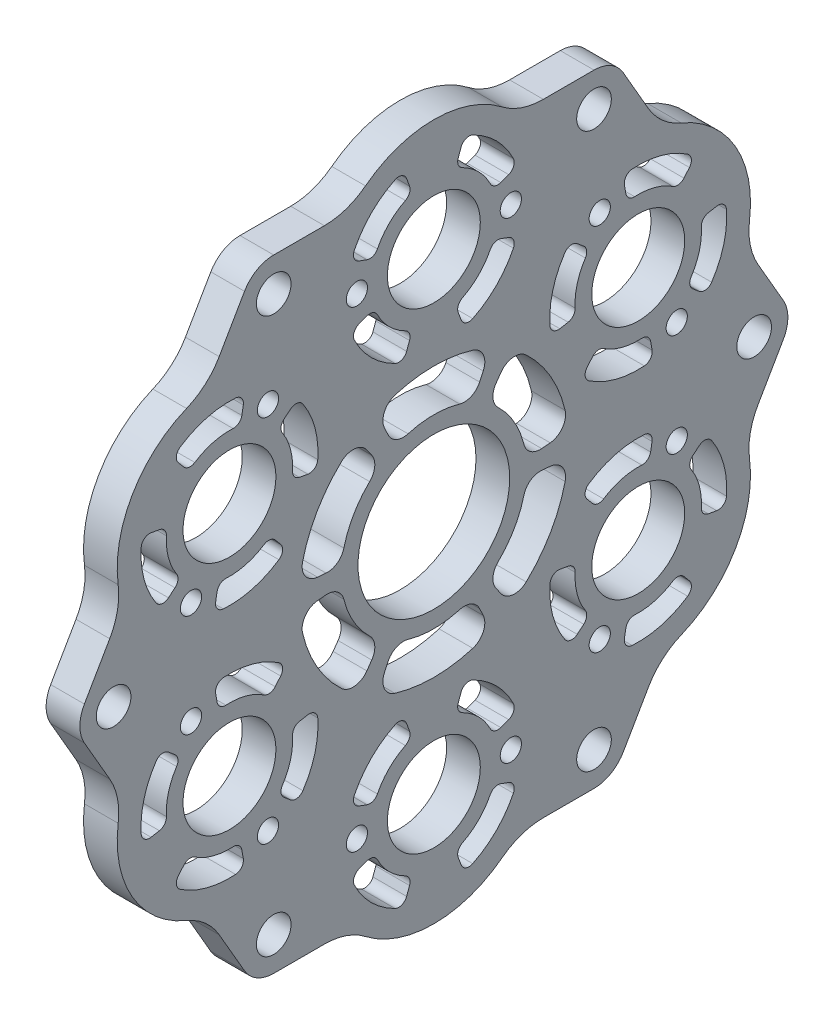
from build123d import *

# Parameters (mm, degrees)
SKETCH1_R                = 3.2639
BOSS_EXTRUDE1_DEPTH      = 6.35
FILLET1_R                = 12.7
SKETCH2_R                = 8.7503
SKETCH2_R_2              = 14.2875
CUT_EXTRUDE1_DEPTH       = 162.968435645
CUT_EXTRUDE2_DEPTH       = 162.968435645
FILLET2_R                = 1.5875
SKETCH4_R                = 1.999996
CUT_EXTRUDE3_DEPTH       = 162.968435645
CUT_EXTRUDE4_DEPTH       = 162.968435645
CIRPATTERN3_COUNT        = 6
FILLET2_OF_CIRPATTERN3_R = 1.5875


with BuildPart() as part:
    # Sketch1 → Boss-Extrude1 (new body)
    with BuildSketch(Plane(origin=(0, 0, 0), x_dir=(0, 0, -1), z_dir=(1, 0, 0))):
        with BuildLine():
            Line((-139.882849365, 15.682852399), (-147.104261314, 3.175))
            ThreePointArc((-147.104261314, 3.175), (-147.955, 0), (-147.104261314, -3.175))
            Line((-147.104261314, -3.175), (-139.882849365, -15.682852399))
            ThreePointArc((-139.882849365, -15.682852399), (-138.087369374, -32.79775), (-124.163173263, -42.910130085))
            Line((-124.163173263, -42.910130085), (-116.941761314, -55.417982483))
            ThreePointArc((-116.941761314, -55.417982483), (-114.6175, -57.742243797), (-111.4425, -58.592982483))
            Line((-111.4425, -58.592982483), (-96.999676101, -58.592982483))
            ThreePointArc((-96.999676101, -58.592982483), (-81.28, -65.5955), (-65.560323899, -58.592982483))
            Line((-65.560323899, -58.592982483), (-51.1175, -58.592982483))
            ThreePointArc((-51.1175, -58.592982483), (-47.9425, -57.742243797), (-45.618238686, -55.417982483))
            Line((-45.618238686, -55.417982483), (-38.396826737, -42.910130085))
            ThreePointArc((-38.396826737, -42.910130085), (-24.472630626, -32.79775), (-22.677150635, -15.682852399))
            Line((-22.677150635, -15.682852399), (-15.455738686, -3.175))
            ThreePointArc((-15.455738686, -3.175), (-14.605, 0), (-15.455738686, 3.175))
            Line((-15.455738686, 3.175), (-22.677150635, 15.682852399))
            ThreePointArc((-22.677150635, 15.682852399), (-24.472630626, 32.79775), (-38.396826737, 42.910130085))
            Line((-38.396826737, 42.910130085), (-45.618238686, 55.417982483))
            ThreePointArc((-45.618238686, 55.417982483), (-47.9425, 57.742243797), (-51.1175, 58.592982483))
            Line((-51.1175, 58.592982483), (-65.560323899, 58.592982483))
            ThreePointArc((-65.560323899, 58.592982483), (-81.28, 65.5955), (-96.999676101, 58.592982483))
            Line((-96.999676101, 58.592982483), (-111.4425, 58.592982483))
            ThreePointArc((-111.4425, 58.592982483), (-114.6175, 57.742243797), (-116.941761314, 55.417982483))
            Line((-116.941761314, 55.417982483), (-124.163173263, 42.910130085))
            ThreePointArc((-124.163173263, 42.910130085), (-138.087369374, 32.79775), (-139.882849365, 15.682852399))
        make_face()
        with Locations((-141.605, 0)):
            Circle(SKETCH1_R, mode=Mode.SUBTRACT)
        with Locations((-111.4425, -52.242982483)):
            Circle(SKETCH1_R, mode=Mode.SUBTRACT)
        with Locations((-111.4425, 52.242982483)):
            Circle(SKETCH1_R, mode=Mode.SUBTRACT)
        with Locations((-51.1175, -52.242982483)):
            Circle(SKETCH1_R, mode=Mode.SUBTRACT)
        with Locations((-51.1175, 52.242982483)):
            Circle(SKETCH1_R, mode=Mode.SUBTRACT)
        with Locations((-20.955, 0)):
            Circle(SKETCH1_R, mode=Mode.SUBTRACT)
    extrude(amount=BOSS_EXTRUDE1_DEPTH)

    # Fillet1
    fillet1_edges = [part.edges().sort_by_distance(p)[0] for p in [
        (3.175, 58.592982483, 96.999676101),
        (3.175, 58.592982483, 65.560323899),
        (3.175, 42.910130085, 38.396826737),
        (3.175, 15.682852399, 22.677150635),
        (3.175, -15.682852399, 22.677150635),
        (3.175, -42.910130085, 38.396826737),
        (3.175, -58.592982483, 65.560323899),
        (3.175, -58.592982483, 96.999676101),
        (3.175, -42.910130085, 124.163173263),
        (3.175, -15.682852399, 139.882849365),
        (3.175, 15.682852399, 139.882849365),
        (3.175, 42.910130085, 124.163173263),
    ]]
    fillet(fillet1_edges, radius=FILLET1_R)

    # Sketch2 → Cut-Extrude1 (cut, through all)
    with BuildSketch(Plane(origin=(6.35, 0, 0), x_dir=(0, 0, -1), z_dir=(1, 0, 0))):
        with Locations((-119.774829198, -22.225)):
            Circle(SKETCH2_R)
        with Locations((-81.28, -44.45)):
            Circle(SKETCH2_R)
        with Locations((-42.785170802, -22.225)):
            Circle(SKETCH2_R)
        with Locations((-42.785170802, 22.225)):
            Circle(SKETCH2_R)
        with Locations((-81.28, 44.45)):
            Circle(SKETCH2_R)
        with Locations((-119.774829198, 22.225)):
            Circle(SKETCH2_R)
        with Locations((-81.28, 0)):
            Circle(SKETCH2_R_2)
    extrude(amount=-CUT_EXTRUDE1_DEPTH, mode=Mode.SUBTRACT)

    # Sketch3 → Cut-Extrude2 (cut, through all)
    with BuildSketch(Plane(origin=(6.35, 0, 0), x_dir=(0, 0, -1), z_dir=(1, 0, 0))):
        with BuildLine():
            Line((-85.352177331, 55.638215266), (-86.981048264, 60.113501373))
            ThreePointArc((-86.981048264, 60.113501373), (-93.066586159, 56.236586159), (-96.943501373, 50.151048264))
            Line((-96.943501373, 50.151048264), (-92.468215266, 48.522177331))
            ThreePointArc((-92.468215266, 48.522177331), (-89.698990114, 52.868990114), (-85.352177331, 55.638215266))
        make_face()
        with BuildLine():
            Line((-77.207822669, 55.638215266), (-75.578951736, 60.113501373))
            ThreePointArc((-75.578951736, 60.113501373), (-69.493413841, 56.236586159), (-65.616498627, 50.151048264))
            Line((-65.616498627, 50.151048264), (-70.091784734, 48.522177331))
            ThreePointArc((-70.091784734, 48.522177331), (-72.861009886, 52.868990114), (-77.207822669, 55.638215266))
        make_face()
        with BuildLine():
            Line((-70.091784734, 40.377822669), (-65.616498627, 38.748951736))
            ThreePointArc((-65.616498627, 38.748951736), (-69.493413841, 32.663413841), (-75.578951736, 28.786498627))
            Line((-75.578951736, 28.786498627), (-77.207822669, 33.261784734))
            ThreePointArc((-77.207822669, 33.261784734), (-72.861009886, 36.031009886), (-70.091784734, 40.377822669))
        make_face()
        with BuildLine():
            Line((-85.352177331, 33.261784734), (-86.981048264, 28.786498627))
            ThreePointArc((-86.981048264, 28.786498627), (-93.066586159, 32.663413841), (-96.943501373, 38.748951736))
            Line((-96.943501373, 38.748951736), (-92.468215266, 40.377822669))
            ThreePointArc((-92.468215266, 40.377822669), (-89.698990114, 36.031009886), (-85.352177331, 33.261784734))
        make_face()
    cut_extrude2 = extrude(amount=-CUT_EXTRUDE2_DEPTH, mode=Mode.SUBTRACT)

    # Fillet2
    fillet2_edges = [part.edges().sort_by_distance(p)[0] for p in [
        (3.175, 50.151048264, 65.616498627),
        (3.175, 48.522177331, 70.091784734),
        (3.175, 55.638215266, 77.207822669),
        (3.175, 60.113501373, 75.578951736),
        (3.175, 28.786498627, 75.578951736),
        (3.175, 33.261784734, 77.207822669),
        (3.175, 40.377822669, 70.091784734),
        (3.175, 38.748951736, 65.616498627),
        (3.175, 38.748951736, 96.943501373),
        (3.175, 40.377822669, 92.468215266),
        (3.175, 33.261784734, 85.352177331),
        (3.175, 28.786498627, 86.981048264),
        (3.175, 55.638215266, 85.352177331),
        (3.175, 48.522177331, 92.468215266),
        (3.175, 50.151048264, 96.943501373),
        (3.175, 60.113501373, 86.981048264),
    ]]
    fillet(fillet2_edges, radius=FILLET2_R)

    # Sketch4 → Cut-Extrude3 (cut, through all)
    with BuildSketch(Plane(origin=(6.35, 0, 0), x_dir=(0, 0, -1), z_dir=(1, 0, 0))):
        with Locations((-66.78041, 44.45)):
            Circle(SKETCH4_R)
        with Locations((-95.77959, 44.45)):
            Circle(SKETCH4_R)
    cut_extrude3 = extrude(amount=-CUT_EXTRUDE3_DEPTH, mode=Mode.SUBTRACT)

    # Sketch6 → Cut-Extrude4 (cut, through all)
    with BuildSketch(Plane(origin=(6.35, 0, 0), x_dir=(0, 0, -1), z_dir=(1, 0, 0))):
        with BuildLine():
            Line((-89.897949909, 18.481253221), (-90.57635303, 19.936093407))
            ThreePointArc((-90.57635303, 19.936093407), (-90.596924838, 22.574689716), (-88.615800921, 24.317607301))
            ThreePointArc((-88.615800921, 24.317607301), (-81.28, 25.4), (-73.944199079, 24.317607301))
            ThreePointArc((-73.944199079, 24.317607301), (-71.963075162, 22.574689716), (-71.98364697, 19.936093407))
            Line((-71.98364697, 19.936093407), (-72.662050091, 18.481253221))
            ThreePointArc((-72.662050091, 18.481253221), (-74.226712204, 16.932216811), (-76.422719266, 16.773363709))
            ThreePointArc((-76.422719266, 16.773363709), (-81.28, 17.4625), (-86.137280734, 16.773363709))
            ThreePointArc((-86.137280734, 16.773363709), (-88.333287796, 16.932216811), (-89.897949909, 18.481253221))
        make_face()
    cut_extrude4 = extrude(amount=-CUT_EXTRUDE4_DEPTH, mode=Mode.SUBTRACT)

    # CirPattern3: Cut-Extrude2, Cut-Extrude3, Cut-Extrude4 ×6 about axis
    cirpattern3_axis = Axis((0, 0, 81.28), (1, 0, 0))
    add([cut_extrude2.rotate(cirpattern3_axis, i * 360 / CIRPATTERN3_COUNT) for i in range(1, CIRPATTERN3_COUNT)], mode=Mode.SUBTRACT)
    add([cut_extrude3.rotate(cirpattern3_axis, i * 360 / CIRPATTERN3_COUNT) for i in range(1, CIRPATTERN3_COUNT)], mode=Mode.SUBTRACT)
    add([cut_extrude4.rotate(cirpattern3_axis, i * 360 / CIRPATTERN3_COUNT) for i in range(1, CIRPATTERN3_COUNT)], mode=Mode.SUBTRACT)

    # Fillet2 of CirPattern3
    fillet2_of_cirpattern3_edges = [part.edges().sort_by_distance(p)[0] for p in [
        (3.175, 38.640514233, 116.880331137),
        (3.175, 33.950367309, 117.707330583),
        (3.175, 31.345716651, 127.428019176),
        (3.175, 34.994003311, 130.489295167),
        (3.175, 19.330501939, 103.359314965),
        (3.175, 20.157501385, 108.049461889),
        (3.175, 29.878189978, 110.654112547),
        (3.175, 32.939465969, 107.005825887),
        (3.175, 5.809485767, 122.66932726),
        (3.175, 10.499632691, 121.842327814),
        (3.175, 13.104283349, 112.12163922),
        (3.175, 9.455996689, 109.060363229),
        (3.175, 24.292498615, 131.500196508),
        (3.175, 14.571810022, 128.895545849),
        (3.175, 11.510534031, 132.543832509),
        (3.175, 25.119498061, 136.190343431),
        (3.175, -11.510534031, 132.543832509),
        (3.175, -14.571810022, 128.895545849),
        (3.175, -24.292498615, 131.500196508),
        (3.175, -25.119498061, 136.190343431),
        (3.175, -9.455996689, 109.060363229),
        (3.175, -13.104283349, 112.12163922),
        (3.175, -10.499632691, 121.842327814),
        (3.175, -5.809485767, 122.66932726),
        (3.175, -32.939465969, 107.005825887),
        (3.175, -29.878189978, 110.654112547),
        (3.175, -20.157501385, 108.049461889),
        (3.175, -19.330501939, 103.359314965),
        (3.175, -31.345716651, 127.428019176),
        (3.175, -33.950367309, 117.707330583),
        (3.175, -38.640514233, 116.880331137),
        (3.175, -34.994003311, 130.489295167),
        (3.175, -50.151048264, 96.943501373),
        (3.175, -48.522177331, 92.468215266),
        (3.175, -55.638215266, 85.352177331),
        (3.175, -60.113501373, 86.981048264),
        (3.175, -28.786498627, 86.981048264),
        (3.175, -33.261784734, 85.352177331),
        (3.175, -40.377822669, 92.468215266),
        (3.175, -38.748951736, 96.943501373),
        (3.175, -38.748951736, 65.616498627),
        (3.175, -40.377822669, 70.091784734),
        (3.175, -33.261784734, 77.207822669),
        (3.175, -28.786498627, 75.578951736),
        (3.175, -55.638215266, 77.207822669),
        (3.175, -48.522177331, 70.091784734),
        (3.175, -50.151048264, 65.616498627),
        (3.175, -60.113501373, 75.578951736),
        (3.175, -38.640514233, 45.679668863),
        (3.175, -33.950367309, 44.852669417),
        (3.175, -31.345716651, 35.131980824),
        (3.175, -34.994003311, 32.070704833),
        (3.175, -19.330501939, 59.200685035),
        (3.175, -20.157501385, 54.510538111),
        (3.175, -29.878189978, 51.905887453),
        (3.175, -32.939465969, 55.554174113),
        (3.175, -5.809485767, 39.89067274),
        (3.175, -10.499632691, 40.717672186),
        (3.175, -13.104283349, 50.43836078),
        (3.175, -9.455996689, 53.499636771),
        (3.175, -24.292498615, 31.059803492),
        (3.175, -14.571810022, 33.664454151),
        (3.175, -11.510534031, 30.016167491),
        (3.175, -25.119498061, 26.369656569),
        (3.175, 11.510534031, 30.016167491),
        (3.175, 14.571810022, 33.664454151),
        (3.175, 24.292498615, 31.059803492),
        (3.175, 25.119498061, 26.369656569),
        (3.175, 9.455996689, 53.499636771),
        (3.175, 13.104283349, 50.43836078),
        (3.175, 10.499632691, 40.717672186),
        (3.175, 5.809485767, 39.89067274),
        (3.175, 32.939465969, 55.554174113),
        (3.175, 29.878189978, 51.905887453),
        (3.175, 20.157501385, 54.510538111),
        (3.175, 19.330501939, 59.200685035),
        (3.175, 31.345716651, 35.131980824),
        (3.175, 33.950367309, 44.852669417),
        (3.175, 38.640514233, 45.679668863),
        (3.175, 34.994003311, 32.070704833),
    ]]
    fillet(fillet2_of_cirpattern3_edges, radius=FILLET2_OF_CIRPATTERN3_R)


solid = part.part
